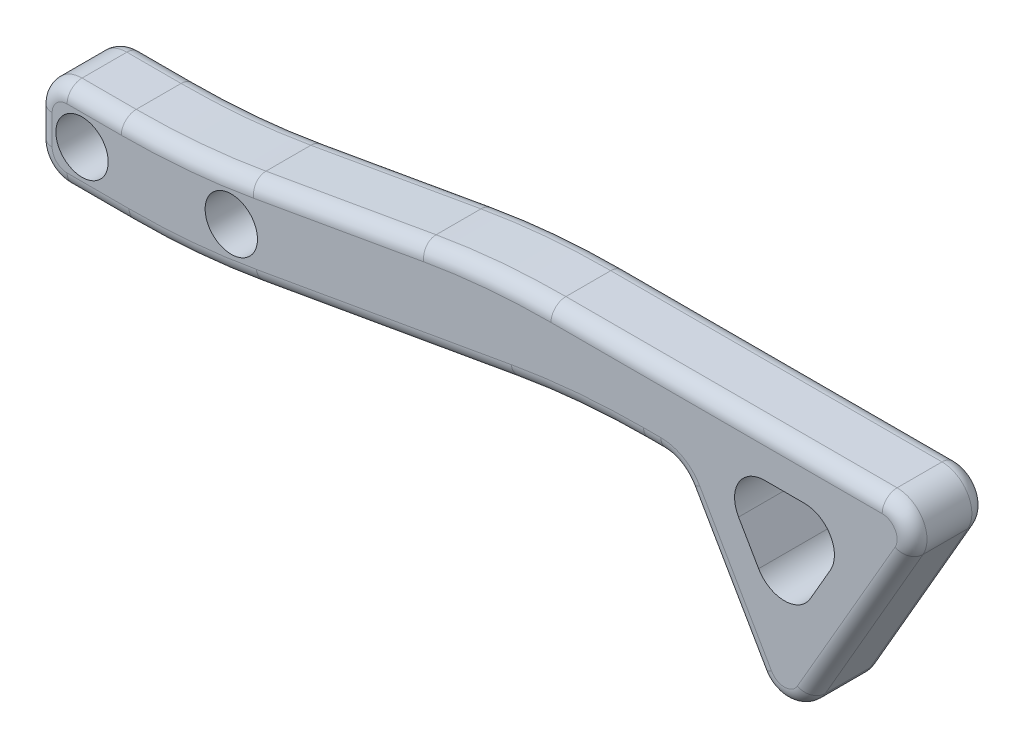
from build123d import *

# Parameters (mm, degrees)
BOSS_EXTRUDE1_DEPTH = 5
FILLET1_R           = 1
SKETCH2_R           = 1.75
CUT_EXTRUDE1_DEPTH  = 35.054632191


with BuildPart() as part:
    # Sketch1 → Boss-Extrude1 (new body)
    with BuildSketch(Plane.XY):
        with BuildLine():
            Line((4.374433176, 0), (26.535898385, 0))
            ThreePointArc((26.535898385, 0), (28.267949192, -1), (28.267949192, -3))
            Line((28.267949192, -3), (21.732050808, -14.320508076))
            ThreePointArc((21.732050808, -14.320508076), (20, -15.320508076), (18.267949192, -14.320508076))
            Line((18.267949192, -14.320508076), (13.464101615, -6))
            ThreePointArc((13.464101615, -6), (12.732050808, -5.267949192), (11.732050808, -5))
            Line((11.732050808, -5), (10.570646977, -5))
            ThreePointArc((10.570646977, -5), (6.21285984, -5.190265095), (1.888238094, -5.759612349))
            Line((1.888238094, -5.759612349), (-15.167092312, -8.766927265))
            ThreePointArc((-15.167092312, -8.766927265), (-19.491714058, -9.336274519), (-23.849501195, -9.526539614))
            Line((-23.849501195, -9.526539614), (-28, -9.526539614))
            ThreePointArc((-28, -9.526539614), (-29.414213562, -8.940753177), (-30, -7.526539614))
            Line((-30, -7.526539614), (-30, -5.526539614))
            ThreePointArc((-30, -5.526539614), (-29.414213562, -4.112326052), (-28, -3.526539614))
            Line((-28, -3.526539614), (-24.374433176, -3.526539614))
            ThreePointArc((-24.374433176, -3.526539614), (-20.016646039, -3.336274519), (-15.692024293, -2.766927265))
            Line((-15.692024293, -2.766927265), (-4.307975707, -0.759612349))
            ThreePointArc((-4.307975707, -0.759612349), (0.016646039, -0.190265095), (4.374433176, 0))
        make_face()
        with BuildLine():
            Line((21.732050808, -8.320508076), (23.07179677, -6))
            ThreePointArc((23.07179677, -6), (23.07179677, -4), (21.339745962, -3))
            Line((21.339745962, -3), (18.660254038, -3))
            ThreePointArc((18.660254038, -3), (16.92820323, -4), (16.92820323, -6))
            Line((16.92820323, -6), (18.267949192, -8.320508076))
            ThreePointArc((18.267949192, -8.320508076), (20, -9.320508076), (21.732050808, -8.320508076))
        make_face(mode=Mode.SUBTRACT)
    extrude(amount=BOSS_EXTRUDE1_DEPTH)

    # Fillet1
    fillet1_edges = [part.edges().sort_by_distance(p)[0] for p in [
        (-19.491714058, -9.336274519, 5),
        (-6.639427109, -7.263269807, 5),
        (-30, -6.526539614, 0),
        (-29.414213562, -4.112326052, 0),
        (-26.187216588, -3.526539614, 0),
        (-20.016646039, -3.336274519, 0),
        (-10, -1.763269807, 0),
        (0.016646039, -0.190265095, 0),
        (15.455165781, 0, 0),
        (28.267949192, -1, 0),
        (25, -8.660254038, 0),
        (6.21285984, -5.190265095, 5),
        (20, -15.320508076, 0),
        (15.866025404, -10.160254038, 0),
        (12.732050808, -5.267949192, 0),
        (11.151348892, -5, 0),
        (6.21285984, -5.190265095, 0),
        (-6.639427109, -7.263269807, 0),
        (-19.491714058, -9.336274519, 0),
        (-25.924750598, -9.526539614, 0),
        (-29.414213562, -8.940753177, 0),
        (11.151348892, -5, 5),
        (12.732050808, -5.267949192, 5),
        (15.866025404, -10.160254038, 5),
        (20, -15.320508076, 5),
        (25, -8.660254038, 5),
        (28.267949192, -1, 5),
        (15.455165781, 0, 5),
        (-29.414213562, -8.940753177, 5),
        (0.016646039, -0.190265095, 5),
        (-10, -1.763269807, 5),
        (-20.016646039, -3.336274519, 5),
        (-26.187216588, -3.526539614, 5),
        (-29.414213562, -4.112326052, 5),
        (-30, -6.526539614, 5),
        (-25.924750598, -9.526539614, 5),
    ]]
    fillet(fillet1_edges, radius=FILLET1_R)

    # Sketch2 → Cut-Extrude1 (cut, through all)
    with BuildSketch(Plane.XY.offset(5)):
        with Locations((-17.013893068, -5.999597174)):
            Circle(SKETCH2_R)
        with Locations((-27, -6.526539614)):
            Circle(SKETCH2_R)
    extrude(amount=-CUT_EXTRUDE1_DEPTH, mode=Mode.SUBTRACT)


solid = part.part
